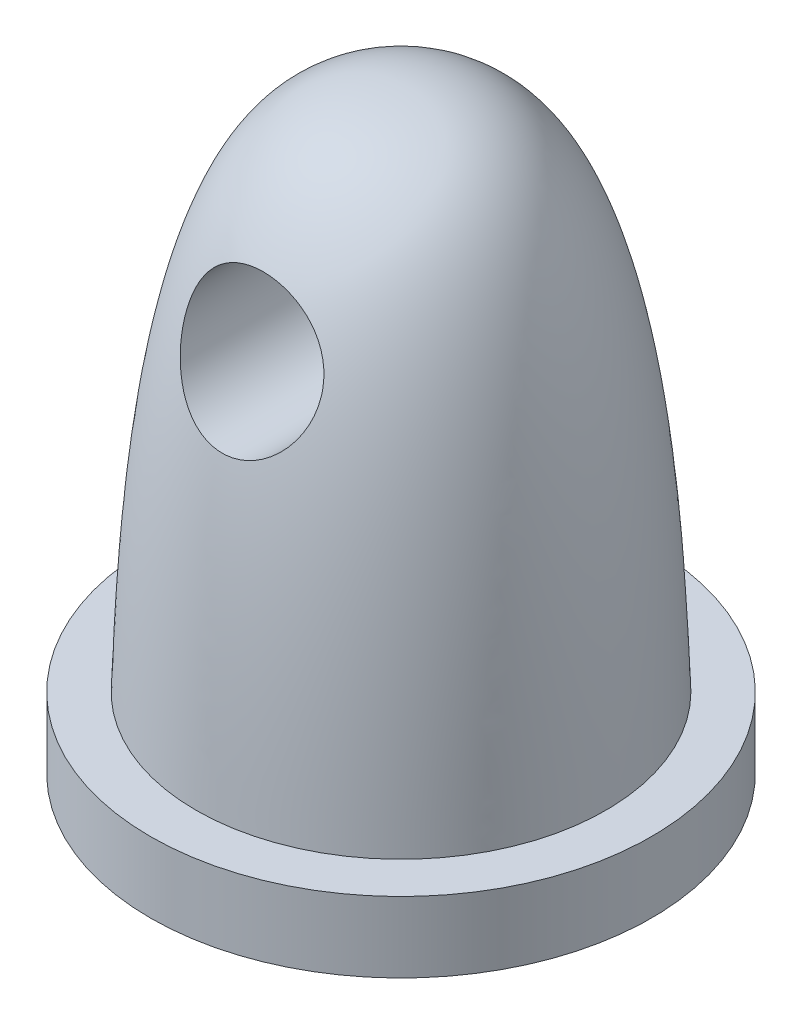
from build123d import *

# Parameters (mm, degrees)
SKETCH1_R           = 5.5
BOSS_EXTRUDE1_DEPTH = 1.55
SKETCH2_R           = 4.5
BOSS_EXTRUDE2_DEPTH = 11.5
SKETCH4_R           = 1.5
CUT_EXTRUDE1_DEPTH  = 5


with BuildPart() as part:
    # Sketch1 → Boss-Extrude1 (new body)
    with BuildSketch(Plane(origin=(0, 0, 0), x_dir=(1, 0, 0), z_dir=(0, 1, 0))):
        Circle(SKETCH1_R)
    extrude(amount=BOSS_EXTRUDE1_DEPTH)

    # Sketch2 → Boss-Extrude2 (add)
    with BuildSketch(Plane(origin=(0, 1.55, 0), x_dir=(1, 0, 0), z_dir=(0, 1, 0))):
        Circle(SKETCH2_R)
    extrude(amount=BOSS_EXTRUDE2_DEPTH)

    # Sketch3 → Cut-Revolve7 (revolve, cut)
    with BuildSketch(Plane.XY):
        with BuildLine():
            Line((0, 13.05), (0, 13.379256314))
            Line((0, 13.379256314), (-5.06381538, 13.379256314))
            Line((-5.06381538, 13.379256314), (-5.06381538, 1.55))
            Line((-5.06381538, 1.55), (-4.5, 1.55))
            add(Edge.make_bspline(
                [(-4.5, 1.55), (-4.418212849, 3.533613751), (-4.258123849, 10.320482708), (-1.721394158, 13.043572847), (0, 13.05)],
                knots=[0, 0, 0, 0, 0.654562443, 1, 1, 1, 1], degree=3))
        make_face()
    revolve(axis=Axis((0, 13.7025, 0), (0, -1, 0)), mode=Mode.SUBTRACT)

    # Sketch4 → Cut-Extrude1 (cut, symmetric)
    with BuildSketch(Plane.XY):
        with Locations((0, 9.55)):
            Circle(SKETCH4_R)
    extrude(amount=CUT_EXTRUDE1_DEPTH, both=True, mode=Mode.SUBTRACT)


solid = part.part
